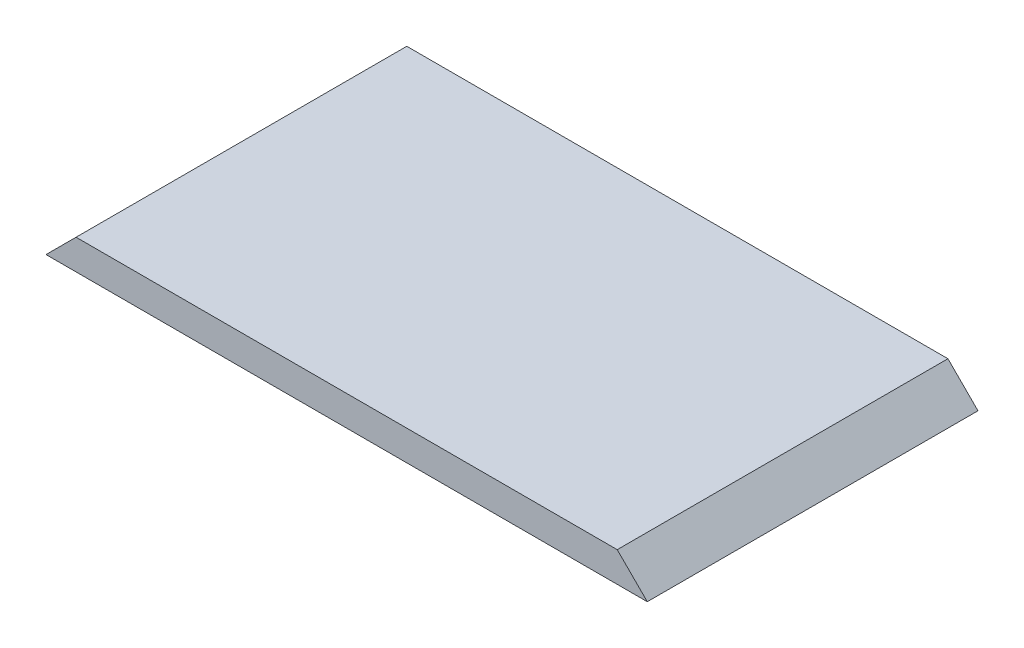
from build123d import *

# Parameters (mm, degrees)
SKETCH2_W           = 100
SKETCH2_H           = 55
BOSS_EXTRUDE1_DEPTH = 5
CUT_EXTRUDE2_REACH  = 116.237
CUT_EXTRUDE3_DEPTH  = 66


with BuildPart() as part:
    # Sketch2 → Boss-Extrude1 (new body)
    with BuildSketch(Plane(origin=(0, 0, 0), x_dir=(1, 0, 0), z_dir=(0, 1, 0))):
        with Locations((-50, 27.5)):
            Rectangle(SKETCH2_W, SKETCH2_H)
    extrude(amount=BOSS_EXTRUDE1_DEPTH)

    # Sketch5 → Cut-Extrude2 (cut, up to next)
    with BuildSketch(Plane.XY, mode=Mode.PRIVATE) as cut_extrude2_sk1:
        Polygon((0, 0), (-5, 5), (0, 5), align=None)
    cut_extrude2_tool1 = extrude(cut_extrude2_sk1.sketch, amount=-CUT_EXTRUDE2_REACH, mode=Mode.PRIVATE) & part.part
    add(cut_extrude2_tool1.solids().sort_by_distance((-1.666667, 3.333333, 0))[0], mode=Mode.SUBTRACT)

    # Sketch3 → Cut-Extrude3 (cut)
    with BuildSketch(Plane.XY):
        Polygon((-100, 0), (-95, 5), (-100, 5), align=None)
    extrude(amount=-CUT_EXTRUDE3_DEPTH, mode=Mode.SUBTRACT)


solid = part.part
